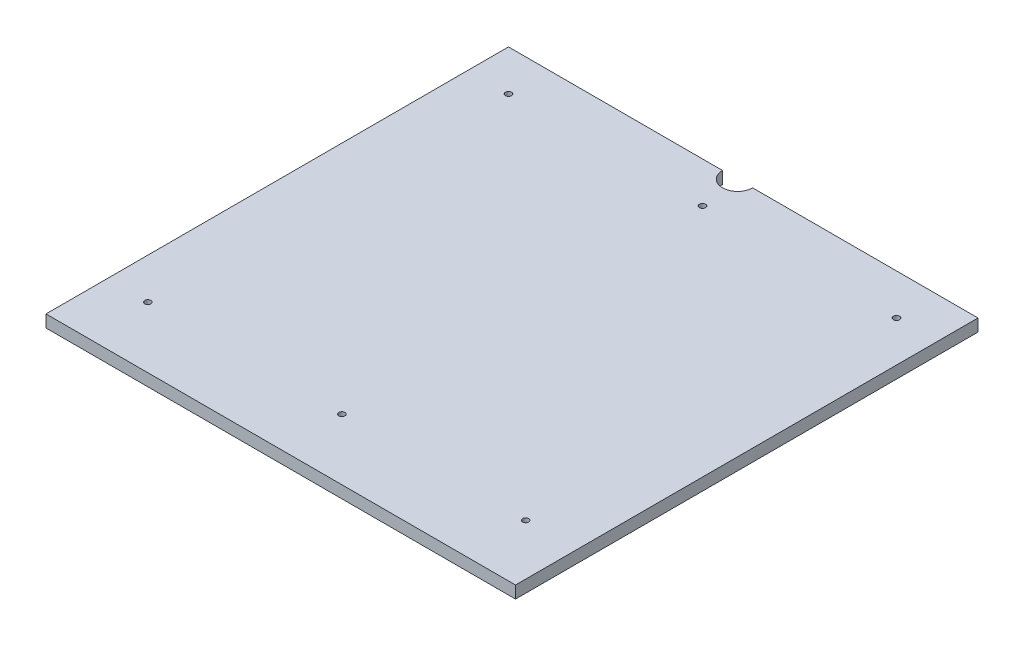
from build123d import *

# Parameters (mm, degrees)
SKETCH_1_R      = 1.5
EXTRUDE_1_DEPTH = 6


with BuildPart() as part:
    # 草图1 → 凸台-拉伸1 (new body)
    with BuildSketch(Plane(origin=(0, 0, 0), x_dir=(1, 0, 0), z_dir=(0, 1, 0))):
        with BuildLine():
            Line((-112.725, 113.5), (-7.662552173, 113.5))
            ThreePointArc((-7.662552173, 113.5), (-0.28, 106.117447827), (7.102552173, 113.5))
            Line((7.102552173, 113.5), (7.5, 113.5))
            Line((7.5, 113.5), (117.725, 113.5))
            Line((117.725, 113.5), (117.725, -113.5))
            Line((117.725, -113.5), (-112.725, -113.5))
            Line((-112.725, -113.5), (-112.725, 113.5))
        make_face()
        with Locations(Location((-92.725, 93.5, 0), (0, 0, 270))):
            Circle(SKETCH_1_R, mode=Mode.SUBTRACT)
        with Locations(Location((97.725, 93.5, 0), (0, 0, 270))):
            Circle(SKETCH_1_R, mode=Mode.SUBTRACT)
        with Locations(Location((2.5, 93.5, 0), (0, 0, 270))):
            Circle(SKETCH_1_R, mode=Mode.SUBTRACT)
        with Locations(Location((-92.725, -83.5, 0), (0, 0, 270))):
            Circle(SKETCH_1_R, mode=Mode.SUBTRACT)
        with Locations(Location((2.5, -83.5, 0), (0, 0, 270))):
            Circle(SKETCH_1_R, mode=Mode.SUBTRACT)
        with Locations(Location((92.725, -83.5, 0), (0, 0, 270))):
            Circle(SKETCH_1_R, mode=Mode.SUBTRACT)
    extrude(amount=EXTRUDE_1_DEPTH)


solid = part.part
